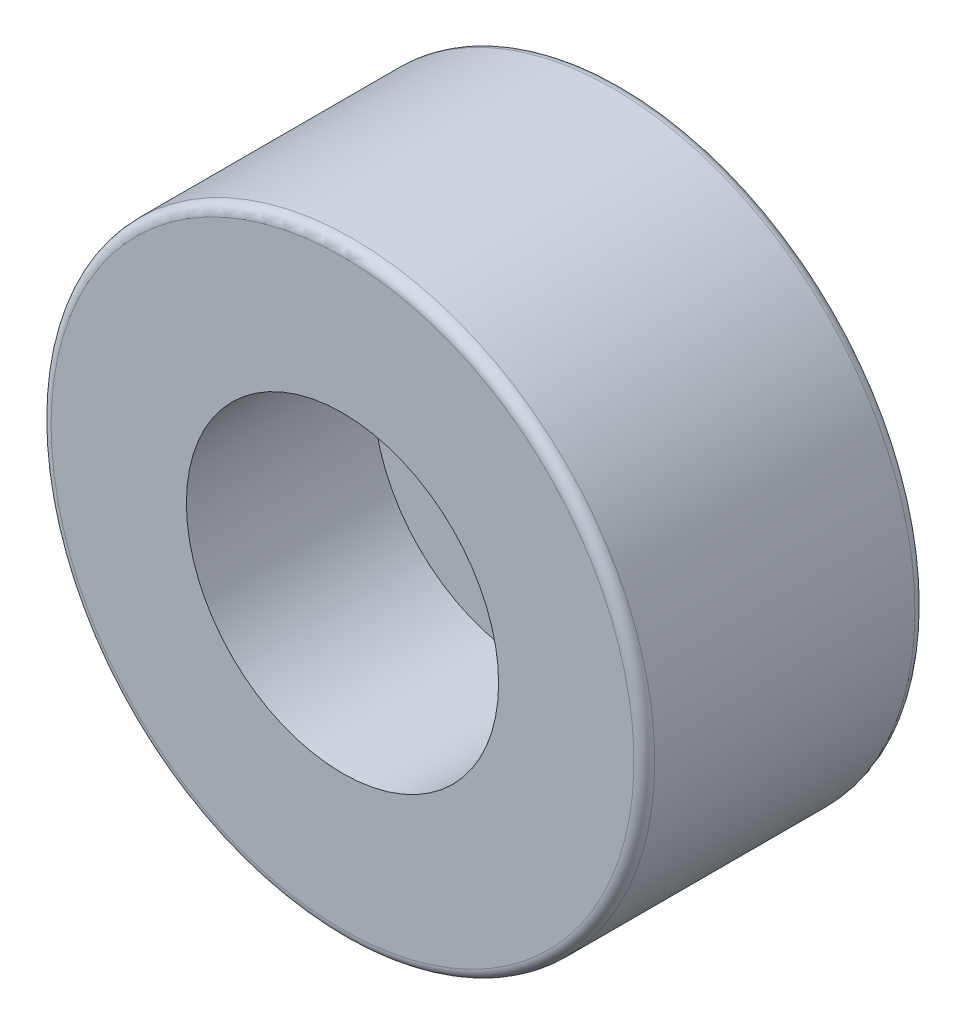
from build123d import *

# Parameters (mm, degrees)
FILLET_1_R = 0.5


with BuildPart() as part:
    # Эскиз1 → Повернуть1 (revolve)
    with BuildSketch(Plane(origin=(0, 0, 0), x_dir=(0, 0, -1), z_dir=(1, 0, 0)), mode=Mode.PRIVATE) as revolve_1_sk:
        Polygon((0, 1.5), (0, 14.5), (-13.5, 14.5), (-13.5, 7.5), (-4.5, 7.5), (-4.5, 1.5), align=None)
    revolve(revolve_1_sk.sketch.rotate(Axis((0, 0, 0), (0, 0, -1)), 90), axis=Axis((0, 0, 0), (0, 0, -1)))

    # Скругление1
    fillet_1_edges = [part.edges().sort_by_distance(p)[0] for p in [
        (-14.5, 0, 13.5),
        (-14.5, 0, 0),
    ]]
    fillet(fillet_1_edges, radius=FILLET_1_R)


solid = part.part
